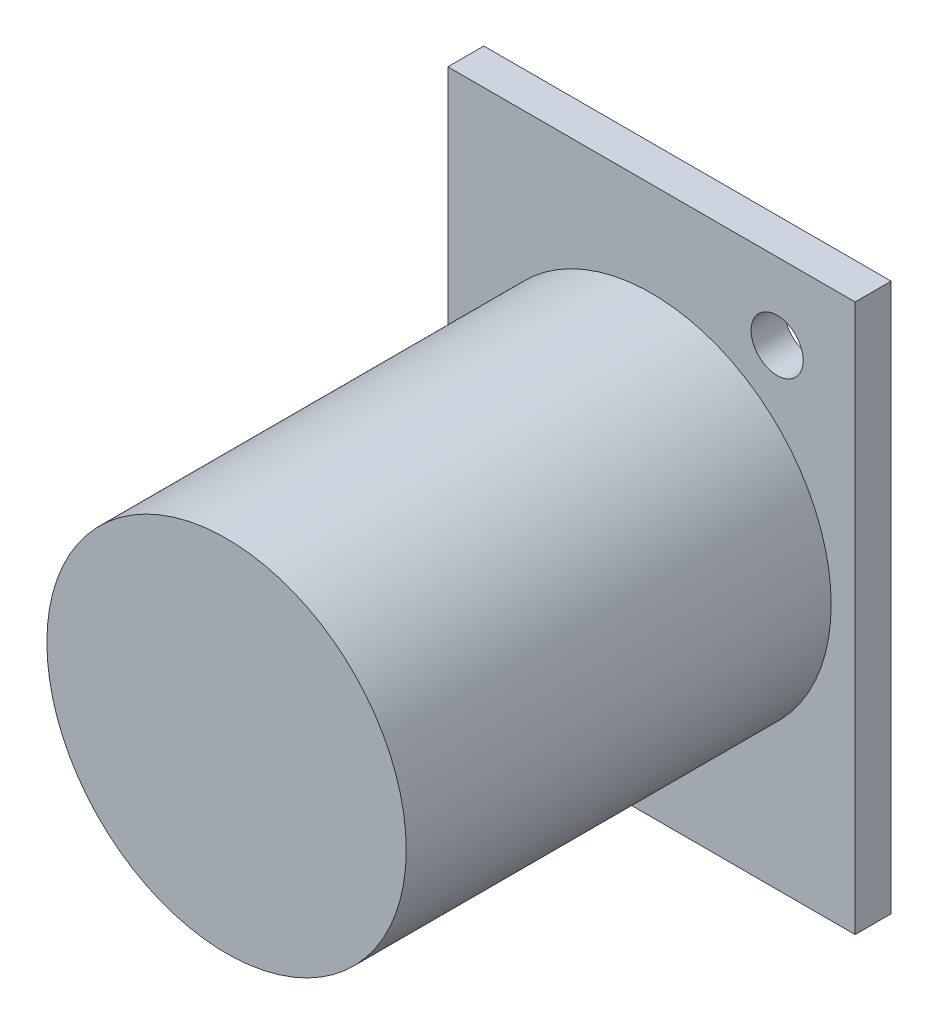
from build123d import *

# Parameters (mm, degrees)
SKETCH1_W           = 27.0002
SKETCH1_H           = 36.322
BOSS_EXTRUDE1_DEPTH = 2.3876
SKETCH2_R           = 11.9126
BOSS_EXTRUDE2_DEPTH = 28.1686
SKETCH3_R           = 10.6426
CUT_EXTRUDE1_DEPTH  = 28.1686
CUT_EXTRUDE2_REACH  = 56.608
SKETCH4_R           = 1.7272
CHAMFER1_SIZE       = 1.1303
CHAMFER1_SIZE2      = 0.158853305


with BuildPart() as part:
    # Sketch1 → Boss-Extrude1 (new body)
    with BuildSketch(Plane.XY):
        with Locations((13.5001, 18.161)):
            Rectangle(SKETCH1_W, SKETCH1_H)
    extrude(amount=BOSS_EXTRUDE1_DEPTH)

    # Sketch2 → Boss-Extrude2 (add)
    with BuildSketch(Plane.XY.offset(2.3876)):
        with Locations(Location((13.5001, 18.161, 0), (0, 0, 180))):
            Circle(SKETCH2_R)
    extrude(amount=BOSS_EXTRUDE2_DEPTH)

    # Sketch3 → Cut-Extrude1 (cut)
    with BuildSketch(Plane(origin=(0, 0, 0), x_dir=(-1, 0, 0), z_dir=(0, 0, -1))):
        with Locations((-13.5001, 18.161)):
            Circle(SKETCH3_R)
    extrude(amount=-CUT_EXTRUDE1_DEPTH, mode=Mode.SUBTRACT)

    # Sketch4 → Cut-Extrude2 (cut, up to next)
    with BuildSketch(Plane(origin=(0, 0, 0), x_dir=(-1, 0, 0), z_dir=(0, 0, -1)), mode=Mode.PRIVATE) as cut_extrude2_sk1:
        with Locations((-21.8313, 31.242)):
            Circle(SKETCH4_R)
    cut_extrude2_tool1 = extrude(cut_extrude2_sk1.sketch, amount=-CUT_EXTRUDE2_REACH, mode=Mode.PRIVATE) & part.part
    # Sketch4 → Cut-Extrude2 (cut, up to next)
    with BuildSketch(Plane(origin=(0, 0, 0), x_dir=(-1, 0, 0), z_dir=(0, 0, -1)), mode=Mode.PRIVATE) as cut_extrude2_sk2:
        with Locations((-5.1689, 5.08)):
            Circle(SKETCH4_R)
    cut_extrude2_tool2 = extrude(cut_extrude2_sk2.sketch, amount=-CUT_EXTRUDE2_REACH, mode=Mode.PRIVATE) & part.part
    add(cut_extrude2_tool1.solids().sort_by_distance((21.8313, 31.242, 0))[0], mode=Mode.SUBTRACT)
    add(cut_extrude2_tool2.solids().sort_by_distance((5.1689, 5.08, 0))[0], mode=Mode.SUBTRACT)

    # Chamfer1
    chamfer1_edges = [part.edges().sort_by_distance(p)[0] for p in [
        (23.5585, 31.242, 0),
        (6.8961, 5.08, 0),
    ]]
    chamfer1_side = [part.faces().sort_by_distance(p)[0] for p in [
        (13.5001, 0.452581317, 0),
    ]]
    chamfer(chamfer1_edges, length=CHAMFER1_SIZE, length2=CHAMFER1_SIZE2, reference=chamfer1_side[0])


solid = part.part
